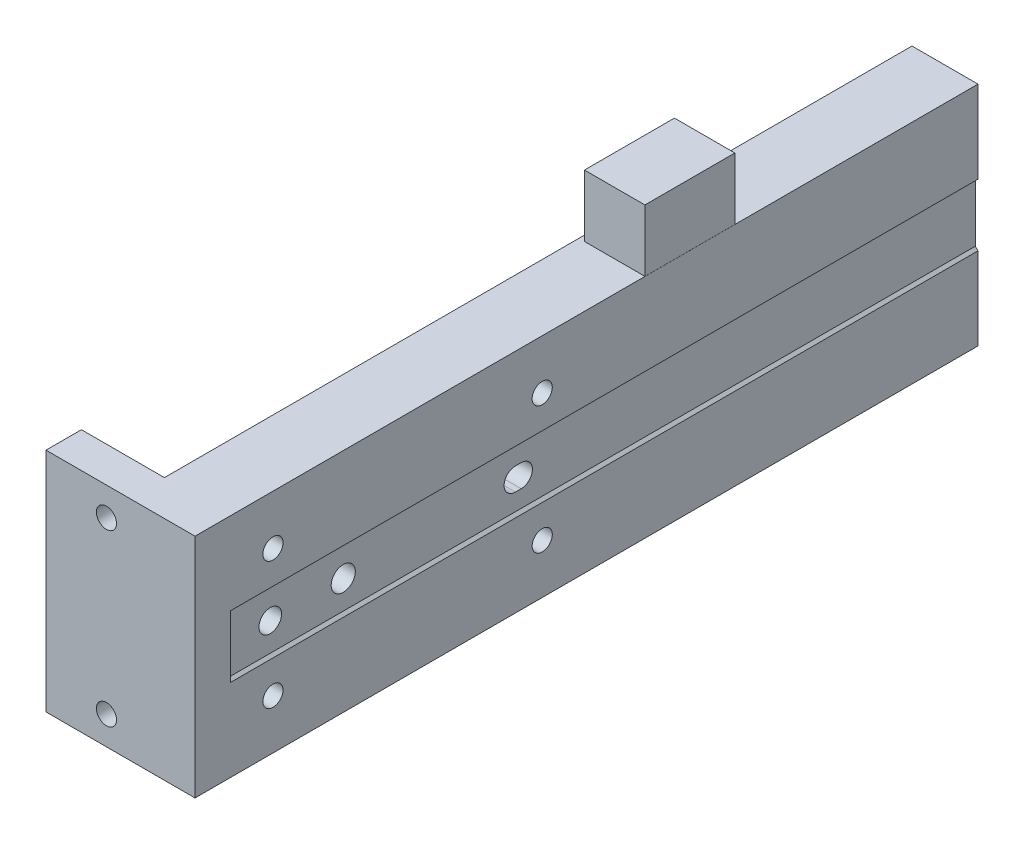
from build123d import *

# Parameters (mm, degrees)
BASE_EXTRUDE_DEPTH              = 5
BOSS_EXTRUDE1_DEPTH             = 105.5
BOSS_EXTRUDE3_DEPTH             = 5
F_3_4_DIAMETER_HOLE1_D          = 3.4
F_4_40_TAPPED_HOLE1_D           = 2.2606
F_4_40_TAPPED_HOLE1_DEPTH       = 7.239
F_4_40_TAPPED_HOLE1_CBORE_D     = 2.8448
F_4_40_TAPPED_HOLE1_CBORE_DEPTH = 4.064
F_4_40_TAPPED_HOLE1_TIP         = 0.679152758
F_4_40_TAPPED_HOLE2_D           = 2.2606
F_4_40_TAPPED_HOLE2_CBORE_D     = 2.8448
F_4_40_TAPPED_HOLE2_CBORE_DEPTH = 5.6896
CUT_EXTRUDE1_DEPTH              = 3.5
HOLE1_D                         = 3.1877
HOLE1_DEPTH                     = 2.54
SKETCH14_W                      = 8.53
SKETCH14_H                      = 12.7
BOSS_EXTRUDE2_DEPTH             = 8.73


with BuildPart() as part:
    # Sketch1 → Base-Extrude (new body)
    with BuildSketch(Plane.XY.offset(-942.568622791)):
        Polygon((-5.1213, 16), (15.9087, 16), (15.9087, 4.38), (15.5287, 4), (15.5287, -4), (15.9087, -4.38), (15.9087, -16), (-5.1213, -16), align=None)
    extrude(amount=BASE_EXTRUDE_DEPTH)

    # Sketch3 → Boss-Extrude1 (add)
    with BuildSketch(Plane(origin=(0, 0, -942.568622791), x_dir=(-1, 0, 0), z_dir=(0, 0, -1))):
        Polygon((-15.9087, 4.38), (-15.9087, 16), (-6.5913, 16), (-6.5913, -16), (-15.9087, -16), (-15.9087, -4.38), (-15.5287, -4), (-15.5287, 4), align=None)
    extrude(amount=BOSS_EXTRUDE1_DEPTH)

    # Sketch15 → Boss-Extrude3 (add)
    with BuildSketch(Plane.XY.offset(-937.568622791)):
        Polygon((15.9087, -4.38), (15.5287, -4), (15.5287, 4), (15.9087, 4.38), align=None)
    extrude(amount=-BOSS_EXTRUDE3_DEPTH)

    # 3.4 Diameter Hole1 (through all)
    with Locations(Plane(origin=(15.5287, 0, 0), x_dir=(0, 0, -1), z_dir=(1, 0, 0))):
        with Locations((958.868622791, 0)):
            Hole(F_3_4_DIAMETER_HOLE1_D / 2)

    # #4-40 Tapped Hole1
    with Locations(Plane(origin=(15.9087, 0, 0), x_dir=(0, 0, -1), z_dir=(1, 0, 0))):
        with Locations((948.568622791, 9), (986.568622791, 9), (948.568622791, -9), (986.568622791, -9)):
            CounterBoreHole(F_4_40_TAPPED_HOLE1_D / 2, F_4_40_TAPPED_HOLE1_CBORE_D / 2, F_4_40_TAPPED_HOLE1_CBORE_DEPTH, depth=F_4_40_TAPPED_HOLE1_DEPTH)
            with Locations((0, 0, -(F_4_40_TAPPED_HOLE1_DEPTH + F_4_40_TAPPED_HOLE1_TIP / 2))):  # 118° drill point
                Cone(0, F_4_40_TAPPED_HOLE1_D / 2, F_4_40_TAPPED_HOLE1_TIP, mode=Mode.SUBTRACT)

    # #4-40 Tapped Hole2 (through all)
    with Locations(Plane.XY.offset(-937.568622791)):
        with Locations((3.4087, 12), (3.4087, -12)):
            CounterBoreHole(F_4_40_TAPPED_HOLE2_D / 2, F_4_40_TAPPED_HOLE2_CBORE_D / 2, F_4_40_TAPPED_HOLE2_CBORE_DEPTH)

    # Sketch11 → Cut-Extrude1 (cut)
    with BuildSketch(Plane(origin=(15.5287, 0, 0), x_dir=(0, 0, -1), z_dir=(1, 0, 0))):
        with BuildLine():
            Line((983.162472791, 1.59385), (983.974772791, 1.59385))
            ThreePointArc((983.974772791, 1.59385), (985.568622791, 0), (983.974772791, -1.59385))
            Line((983.974772791, -1.59385), (983.162472791, -1.59385))
            ThreePointArc((983.162472791, -1.59385), (981.568622791, 0), (983.162472791, 1.59385))
        make_face()
    extrude(amount=-CUT_EXTRUDE1_DEPTH, mode=Mode.SUBTRACT)

    # Hole1
    with Locations(Plane(origin=(15.5287, 0, 0), x_dir=(0, 0, -1), z_dir=(1, 0, 0))):
        with Locations((948.568622791, 0)):
            Hole(HOLE1_D / 2, depth=HOLE1_DEPTH)

    # Sketch14 → Boss-Extrude2 (add)
    with BuildSketch(Plane(origin=(0, 16, 0), x_dir=(-1, 0, 0), z_dir=(0, 1, 0))):
        with Locations((-11.6337, -1007.418622791)):
            Rectangle(SKETCH14_W, SKETCH14_H)
    extrude(amount=BOSS_EXTRUDE2_DEPTH)


solid = part.part
